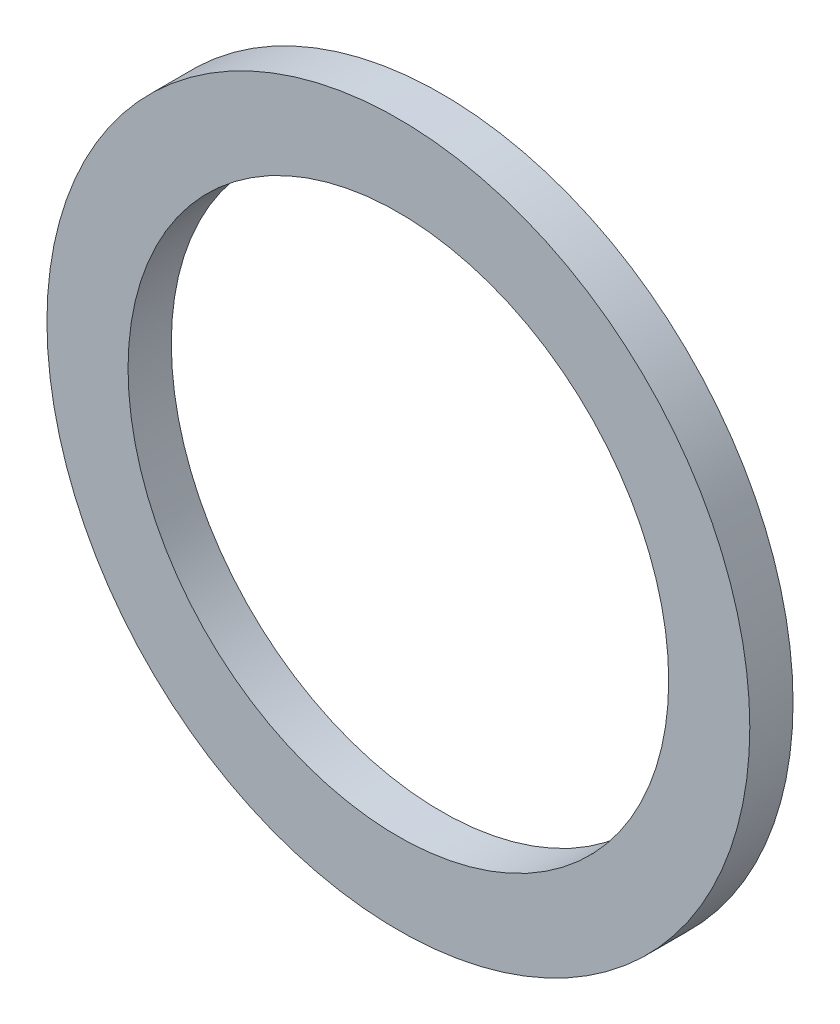
from build123d import *

# Parameters (mm, degrees)
ESQUISSE1_R        = 6.5
ESQUISSE1_R_2      = 5
BOSS_EXTRU_1_DEPTH = 0.8


with BuildPart() as part:
    # Esquisse1 → Boss.-Extru.1 (new body)
    with BuildSketch(Plane.XY):
        Circle(ESQUISSE1_R)
        Circle(ESQUISSE1_R_2, mode=Mode.SUBTRACT)
    extrude(amount=BOSS_EXTRU_1_DEPTH)


solid = part.part
